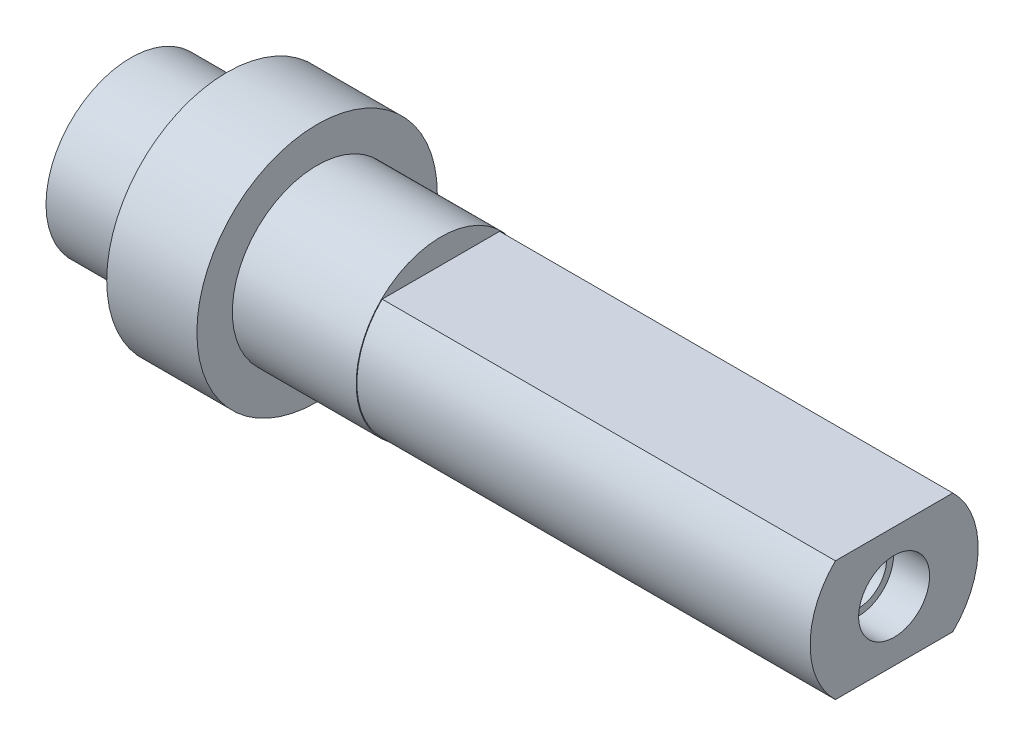
from build123d import *

# Parameters (mm, degrees)
SKETCH_2_R           = 5
EXTRUDE_1_DEPTH      = 3.75
SKETCH_3_R           = 3.525
EXTRUDE_2_DEPTH      = 4
EXTRUDE_START        = 24
SKETCH_4_R           = 3.525
EXTRUDE_3_DEPTH      = 24
CUT_EXTRUDE_START    = 5.15
SKETCH_5_OUTSIDE_W   = 18.952
SKETCH_5_OUTSIDE_H   = 18.952
SKETCH_5_OUTSIDE_W_2 = 12.787470862
SKETCH_5_OUTSIDE_H_2 = 5
CUT_EXTRUDE_1_DEPTH  = 19.08
SKETCH_6_R           = 1.19
CUT_EXTRUDE_2_DEPTH  = 8
SKETCH_7_R           = 1.475
CUT_EXTRUDE_3_DEPTH  = 1.5
SKETCH_8_OUTSIDE_W   = 18.952
SKETCH_8_OUTSIDE_H   = 18.952
SKETCH_8_OUTSIDE_R   = 3.495
CUT_EXTRUDE_5_DEPTH  = 18.85


with BuildPart() as part:
    # 草图2 → 凸台-拉伸1 (new body)
    with BuildSketch(Plane(origin=(0, 0, 0), x_dir=(0, 0, -1), z_dir=(1, 0, 0))):
        Circle(SKETCH_2_R)
    extrude(amount=EXTRUDE_1_DEPTH)

    # 草图3 → 凸台-拉伸2 (add)
    with BuildSketch(Plane.ZY):
        Circle(SKETCH_3_R)
    extrude(amount=EXTRUDE_2_DEPTH)

    # 草图4 → 凸台-拉伸3 (add)
    with BuildSketch(Plane(origin=(3.75, 0, 0), x_dir=(0, 0, -1), z_dir=(1, 0, 0)).offset(EXTRUDE_START)):
        with Locations(Location((0, 0, 0), (0, 0, 180))):
            Circle(SKETCH_4_R)
    extrude(amount=-EXTRUDE_3_DEPTH)

    # 草图5 outside → 切除-拉伸1 (cut)
    with BuildSketch(Plane(origin=(3.75, 0, 0), x_dir=(0, 0, -1), z_dir=(1, 0, 0)).offset(CUT_EXTRUDE_START)):
        Rectangle(SKETCH_5_OUTSIDE_W, SKETCH_5_OUTSIDE_H)
        Rectangle(SKETCH_5_OUTSIDE_W_2, SKETCH_5_OUTSIDE_H_2, mode=Mode.SUBTRACT)
    extrude(amount=CUT_EXTRUDE_1_DEPTH, mode=Mode.SUBTRACT)

    # 草图6 → 切除-拉伸2 (cut)
    with BuildSketch(Plane(origin=(27.75, 0, 0), x_dir=(0, 0, -1), z_dir=(1, 0, 0))):
        Circle(SKETCH_6_R)
    extrude(amount=-CUT_EXTRUDE_2_DEPTH, mode=Mode.SUBTRACT)

    # 草图7 → 切除-拉伸3 (cut)
    with BuildSketch(Plane(origin=(27.75, 0, 0), x_dir=(0, 0, -1), z_dir=(1, 0, 0))):
        Circle(SKETCH_7_R)
    extrude(amount=-CUT_EXTRUDE_3_DEPTH, mode=Mode.SUBTRACT)

    # 草图8 outside → 切除-拉伸5 (cut)
    with BuildSketch(Plane(origin=(27.75, 0, 0), x_dir=(0, 0, -1), z_dir=(1, 0, 0))):
        Rectangle(SKETCH_8_OUTSIDE_W, SKETCH_8_OUTSIDE_H)
        Circle(SKETCH_8_OUTSIDE_R, mode=Mode.SUBTRACT)
    extrude(amount=-CUT_EXTRUDE_5_DEPTH, mode=Mode.SUBTRACT)


solid = part.part
